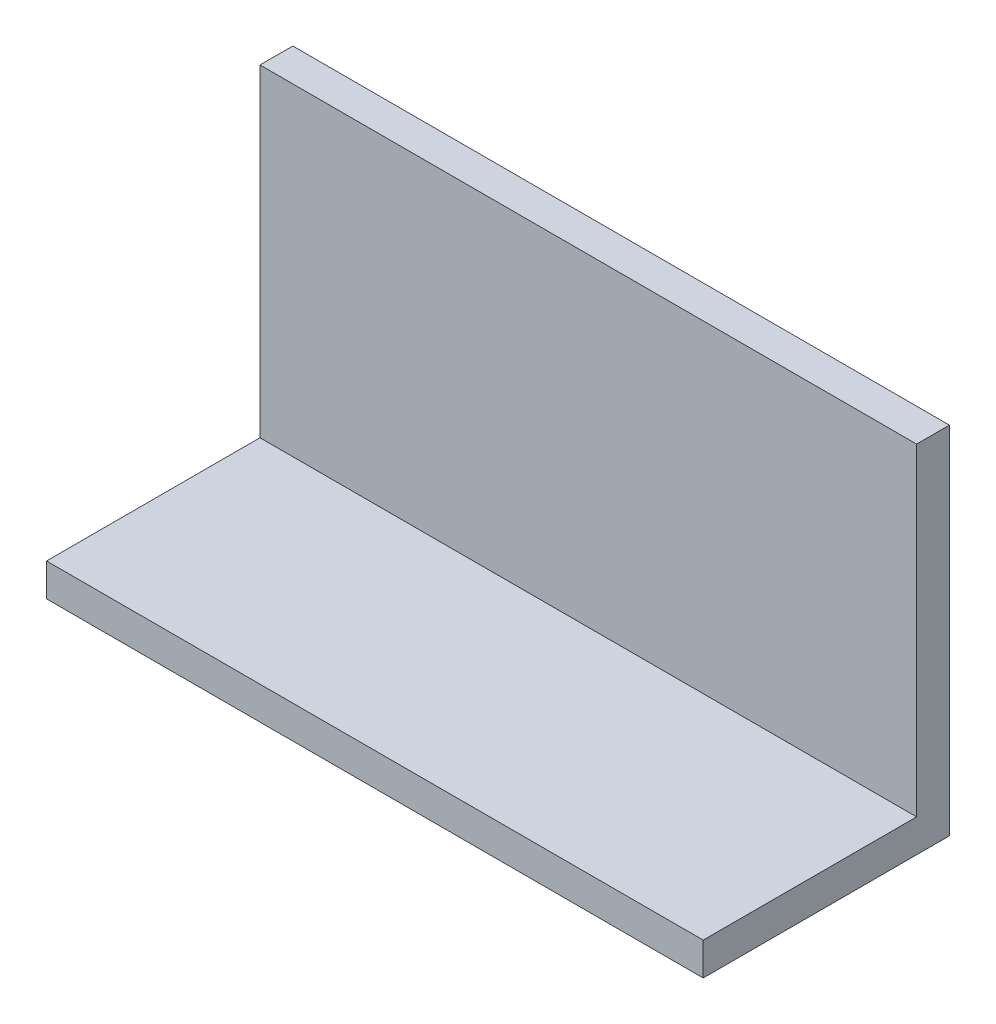
from build123d import *

# Parameters (mm, degrees)
SKETCH_1_W          = 240
SKETCH_1_H          = 130
EXTRUDE_1_DEPTH     = 90
SKETCH_2_W          = 78
SKETCH_2_H          = 118
CUT_EXTRUDE_1_DEPTH = 288.402157264


with BuildPart() as part:
    # 草图1 → 凸台-拉伸1 (new body)
    with BuildSketch(Plane.XY):
        with Locations((120, 65)):
            Rectangle(SKETCH_1_W, SKETCH_1_H)
    extrude(amount=EXTRUDE_1_DEPTH)

    # 草图2 → 切除-拉伸1 (cut, through all)
    with BuildSketch(Plane.ZY):
        with Locations((51, 71)):
            Rectangle(SKETCH_2_W, SKETCH_2_H)
    extrude(amount=-CUT_EXTRUDE_1_DEPTH, mode=Mode.SUBTRACT)


solid = part.part
